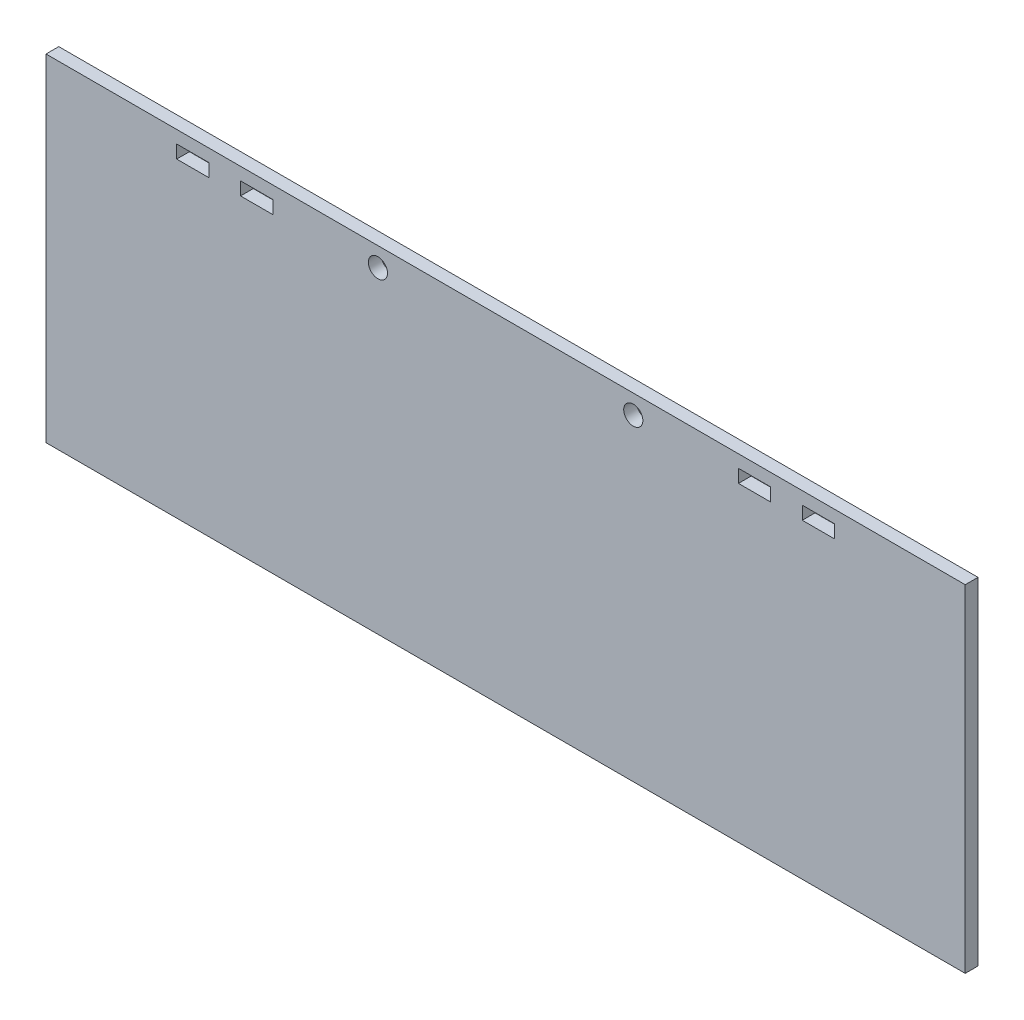
from build123d import *

# Parameters (mm, degrees)
SKETCH_1_R      = 1.5
SKETCH_1_W      = 5.05
SKETCH_1_H      = 2.05
EXTRUDE_1_DEPTH = 2


with BuildPart() as part:
    # 草图1 → 凸台-拉伸1 (new body)
    with BuildSketch(Plane.XY):
        Polygon((-17.723146761, 1.973092798), (-17.723146761, -50.760914608), (126.276853239, -50.760914608), (126.276853239, 1.973092798), (54.276853239, 1.973092798), align=None)
        with Locations((34.275, -1.025)):
            Circle(SKETCH_1_R, mode=Mode.SUBTRACT)
        with Locations((74.275, -1.025)):
            Circle(SKETCH_1_R, mode=Mode.SUBTRACT)
        with Locations((15.275, -1.025)):
            Rectangle(SKETCH_1_W, SKETCH_1_H, mode=Mode.SUBTRACT)
        with Locations((5.275, -1.025)):
            Rectangle(SKETCH_1_W, SKETCH_1_H, mode=Mode.SUBTRACT)
        with Locations((103.275, -1.025)):
            Rectangle(SKETCH_1_W, SKETCH_1_H, mode=Mode.SUBTRACT)
        with Locations((93.275, -1.025)):
            Rectangle(SKETCH_1_W, SKETCH_1_H, mode=Mode.SUBTRACT)
    extrude(amount=EXTRUDE_1_DEPTH)


solid = part.part
